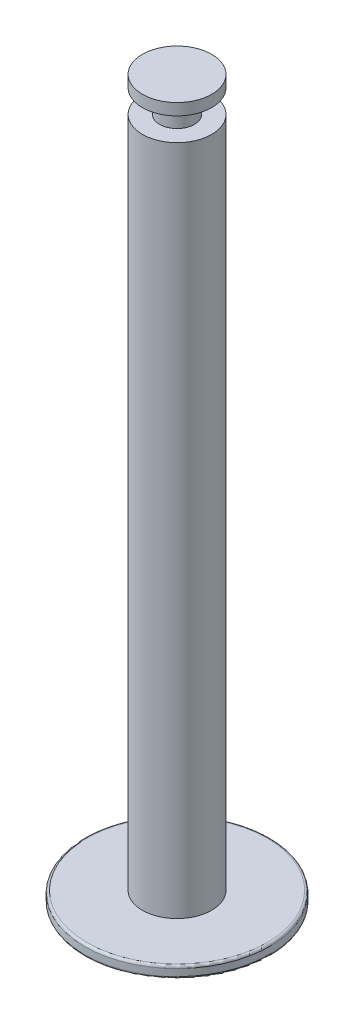
from build123d import *

# Parameters (mm, degrees)
SKETCH1_R           = 7.99
BOSS_EXTRUDE1_DEPTH = 1
FILLET1_R           = 0.2
SKETCH2_R           = 2.99
BOSS_EXTRUDE3_DEPTH = 58
SKETCH4_R           = 1.5
BOSS_EXTRUDE4_DEPTH = 2
SKETCH5_R           = 2.99
BOSS_EXTRUDE5_DEPTH = 1


with BuildPart() as part:
    # Sketch1 → Boss-Extrude1 (new body)
    with BuildSketch(Plane(origin=(0, 0, 0), x_dir=(1, 0, 0), z_dir=(0, 1, 0))):
        Circle(SKETCH1_R)
    extrude(amount=BOSS_EXTRUDE1_DEPTH)

    # Fillet1
    fillet1_edges = [part.edges().sort_by_distance(p)[0] for p in [
        (-7.99, 0, 0),
        (-7.99, 1, 0),
    ]]
    fillet(fillet1_edges, radius=FILLET1_R)

    # Sketch2 → Boss-Extrude3 (add)
    with BuildSketch(Plane(origin=(0, 1, 0), x_dir=(1, 0, 0), z_dir=(0, 1, 0))):
        Circle(SKETCH2_R)
    extrude(amount=BOSS_EXTRUDE3_DEPTH)

    # Sketch4 → Boss-Extrude4 (add)
    with BuildSketch(Plane(origin=(0, 59, 0), x_dir=(1, 0, 0), z_dir=(0, 1, 0))):
        Circle(SKETCH4_R)
    extrude(amount=BOSS_EXTRUDE4_DEPTH)

    # Sketch5 → Boss-Extrude5 (add)
    with BuildSketch(Plane(origin=(0, 61, 0), x_dir=(1, 0, 0), z_dir=(0, 1, 0))):
        Circle(SKETCH5_R)
    extrude(amount=BOSS_EXTRUDE5_DEPTH)


solid = part.part
